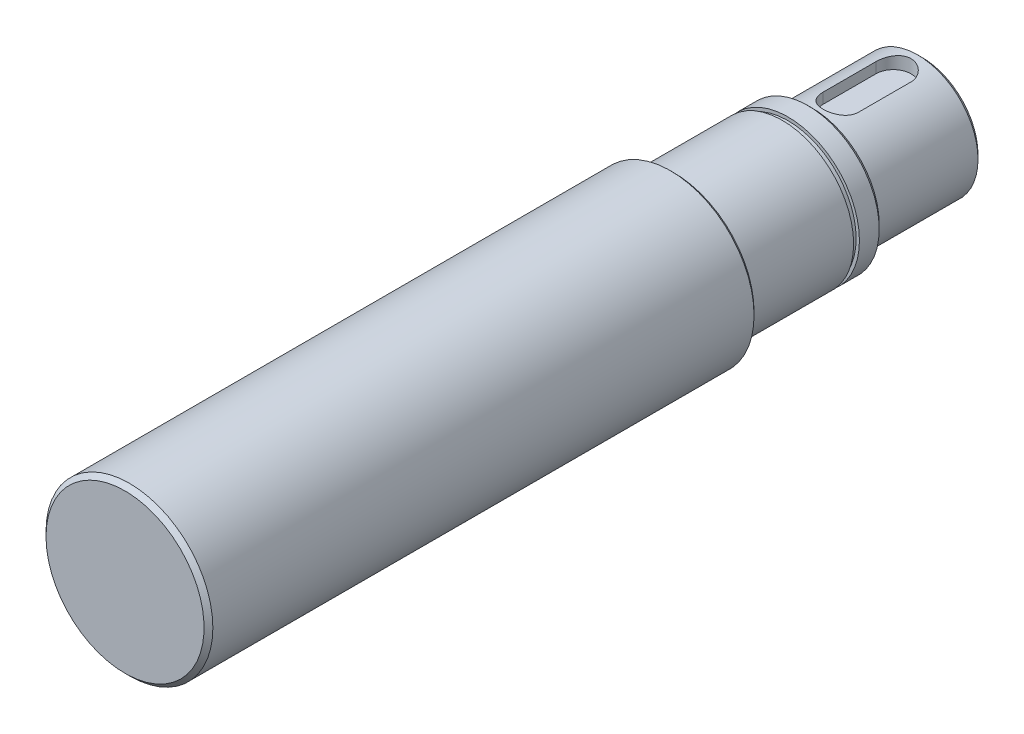
from build123d import *

# Parameters (mm, degrees)
CHAMFER_1_SIZE      = 2
CHAMFER_2_SIZE      = 1.5
CUT_EXTRUDE_1_DEPTH = 6
CHAMFER_3_SIZE      = 2


with BuildPart() as part:
    # Эскиз1 → Повернуть1 (revolve)
    with BuildSketch(Plane(origin=(0, 0, 0), x_dir=(0, 0, -1), z_dir=(1, 0, 0)), mode=Mode.PRIVATE) as revolve_1_sk:
        Polygon((0, 0), (0, 38), (250, 38), (250, 32.5), (299.35, 32.5), (299.35, 31), (302, 31), (302, 32.5), (313, 32.5), (313, 27.5), (363, 27.5), (363, 0), align=None)
    revolve(revolve_1_sk.sketch.rotate(Axis((0, 0, 0), (0, 0, -1)), 90), axis=Axis((0, 0, 0), (0, 0, -1)))

    # Фаска1
    chamfer_1_edges = [part.edges().sort_by_distance(p)[0] for p in [
        (-38, 0, 0),
        (-27.5, 0, -363),
    ]]
    chamfer(chamfer_1_edges, length=CHAMFER_1_SIZE)

    # Фаска2
    chamfer_2_edges = [part.edges().sort_by_distance(p)[0] for p in [
        (-38, 0, -250),
    ]]
    chamfer(chamfer_2_edges, length=CHAMFER_2_SIZE)

    # Эскиз8 → Вырез-Вытянуть1 (cut)
    with BuildSketch(Plane(origin=(-6.6, 27.5, -280), x_dir=(-1, 0, 0), z_dir=(0, -1, 0))):
        with BuildLine():
            Line((1.4, 70), (1.4, 46))
            ThreePointArc((1.4, 46), (-6.6, 38), (-14.6, 46))
            Line((-14.6, 46), (-14.6, 70))
            ThreePointArc((-14.6, 70), (-6.6, 78), (1.4, 70))
        make_face()
    extrude(amount=CUT_EXTRUDE_1_DEPTH, mode=Mode.SUBTRACT)

    # Фаска3
    chamfer_3_edges = [part.edges().sort_by_distance(p)[0] for p in [
        (-32.5, 0, -313),
    ]]
    chamfer(chamfer_3_edges, length=CHAMFER_3_SIZE)


solid = part.part
